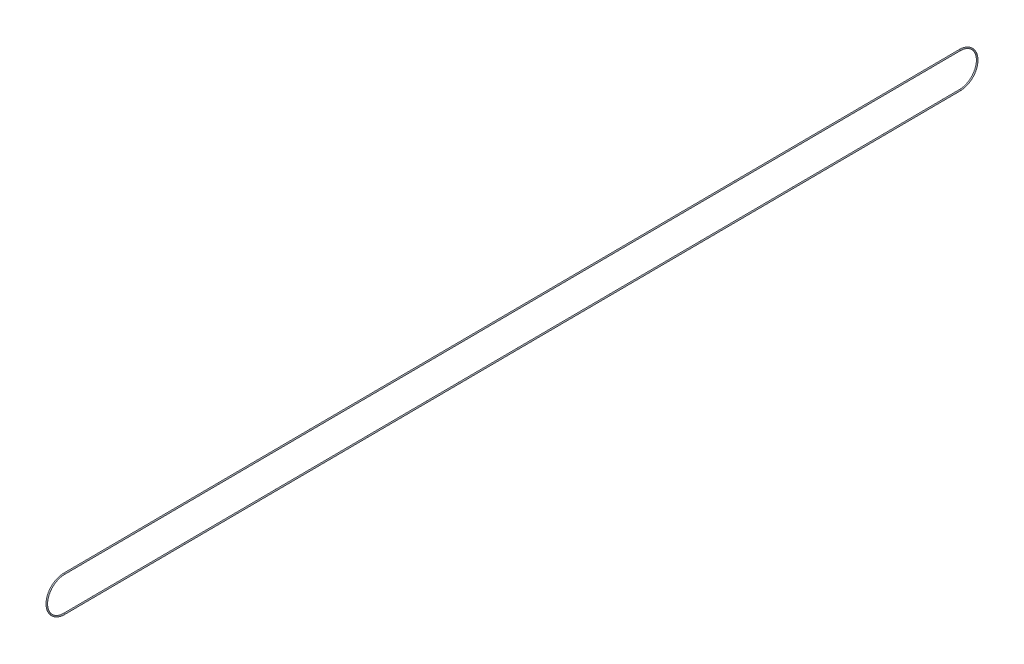
from build123d import *

# Parameters (mm, degrees)
SWEEP1_PROFILE_R = 0.75


with BuildPart() as part:
    # Sweep1: sweep along a path in Sketch1
    with BuildLine(Plane(origin=(0, 0, 0), x_dir=(0, 0, -1), z_dir=(1, 0, 0))) as sweep1_path:
        Line((-580.143309195, 18.80527609), (579.856690805, 26.193811122))
        ThreePointArc((579.856690805, 26.193811122), (602.499543606, 3.837576711), (580.143309195, -18.80527609))
        Line((580.143309195, -18.80527609), (-579.856690805, -26.193811122))
        ThreePointArc((-579.856690805, -26.193811122), (-602.499543606, -3.837576711), (-580.143309195, 18.80527609))
    # Sweep1 profile (on start of the path) → Sweep1 (sweep)
    with BuildSketch(Plane(origin=(0, 18.80527609, 580.143309195), x_dir=(0, -0.9999797158186168, -0.006369297552985365), z_dir=(0, 0.006369297552985365, -0.9999797158186168))):
        Circle(SWEEP1_PROFILE_R)
    sweep(path=sweep1_path.line)


solid = part.part
